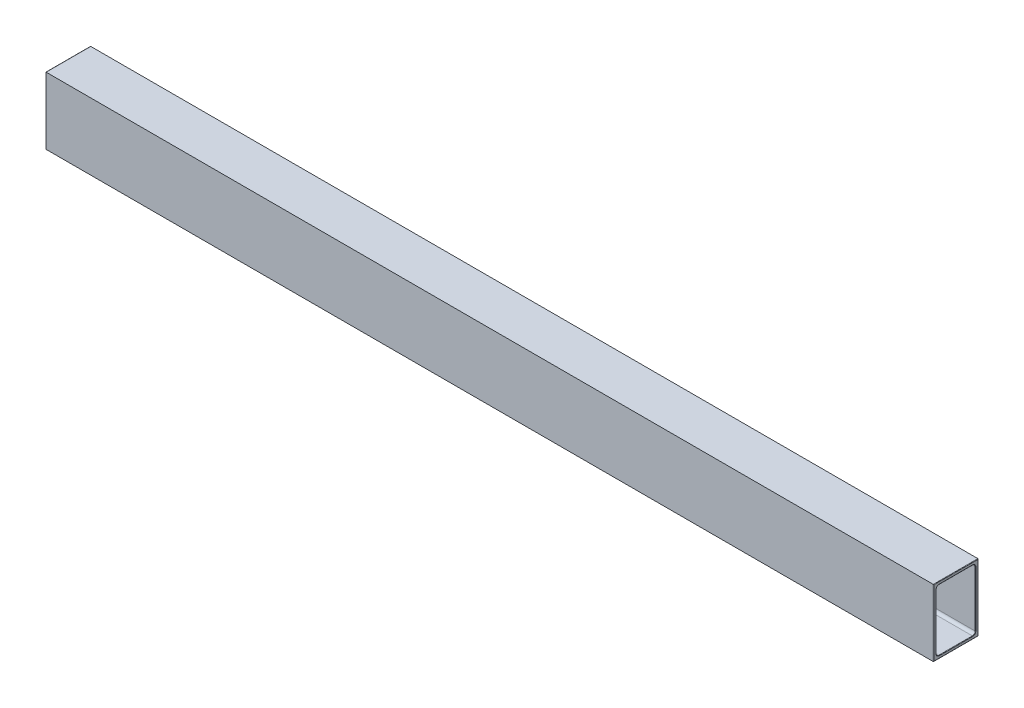
from build123d import *

# Parameters (mm, degrees)
SKETCH1_W           = 101.6
SKETCH1_H           = 152.4
BOSS_EXTRUDE1_DEPTH = 2022.60499974
FILLET1_R           = 1


with BuildPart() as part:
    # Sketch1 → Boss-Extrude1 (new body)
    with BuildSketch(Plane(origin=(0, 0, 0), x_dir=(0, 0, -1), z_dir=(1, 0, 0))):
        with Locations((-50.8, 76.2)):
            Rectangle(SKETCH1_W, SKETCH1_H)
        with BuildLine():
            Line((-95.25, 12.7), (-95.25, 139.7))
            ThreePointArc((-95.25, 139.7), (-93.390128061, 144.190128061), (-88.9, 146.05))
            Line((-88.9, 146.05), (-12.7, 146.05))
            ThreePointArc((-12.7, 146.05), (-8.209871939, 144.190128061), (-6.35, 139.7))
            Line((-6.35, 139.7), (-6.35, 12.7))
            ThreePointArc((-6.35, 12.7), (-8.209871939, 8.209871939), (-12.7, 6.35))
            Line((-12.7, 6.35), (-88.9, 6.35))
            ThreePointArc((-88.9, 6.35), (-93.390128061, 8.209871939), (-95.25, 12.7))
        make_face(mode=Mode.SUBTRACT)
    extrude(amount=BOSS_EXTRUDE1_DEPTH)

    # Fillet1
    fillet1_edges = [part.edges().sort_by_distance(p)[0] for p in [
        (2022.60499974, 76.2, 101.6),
        (2022.60499974, 0, 50.8),
        (0, 8.209871939, 93.390128061),
        (0, 6.35, 50.8),
        (0, 8.209871939, 8.209871939),
        (0, 76.2, 6.35),
        (0, 144.190128061, 8.209871939),
        (0, 146.05, 50.8),
        (0, 144.190128061, 93.390128061),
        (0, 76.2, 95.25),
        (2022.60499974, 8.209871939, 93.390128061),
        (2022.60499974, 6.35, 50.8),
        (2022.60499974, 8.209871939, 8.209871939),
        (2022.60499974, 76.2, 6.35),
        (2022.60499974, 144.190128061, 8.209871939),
        (2022.60499974, 146.05, 50.8),
        (2022.60499974, 144.190128061, 93.390128061),
        (2022.60499974, 76.2, 95.25),
        (2022.60499974, 76.2, 0),
        (0, 0, 50.8),
        (0, 76.2, 101.6),
        (0, 152.4, 50.8),
        (0, 76.2, 0),
        (2022.60499974, 152.4, 50.8),
    ]]
    fillet(fillet1_edges, radius=FILLET1_R)


solid = part.part
